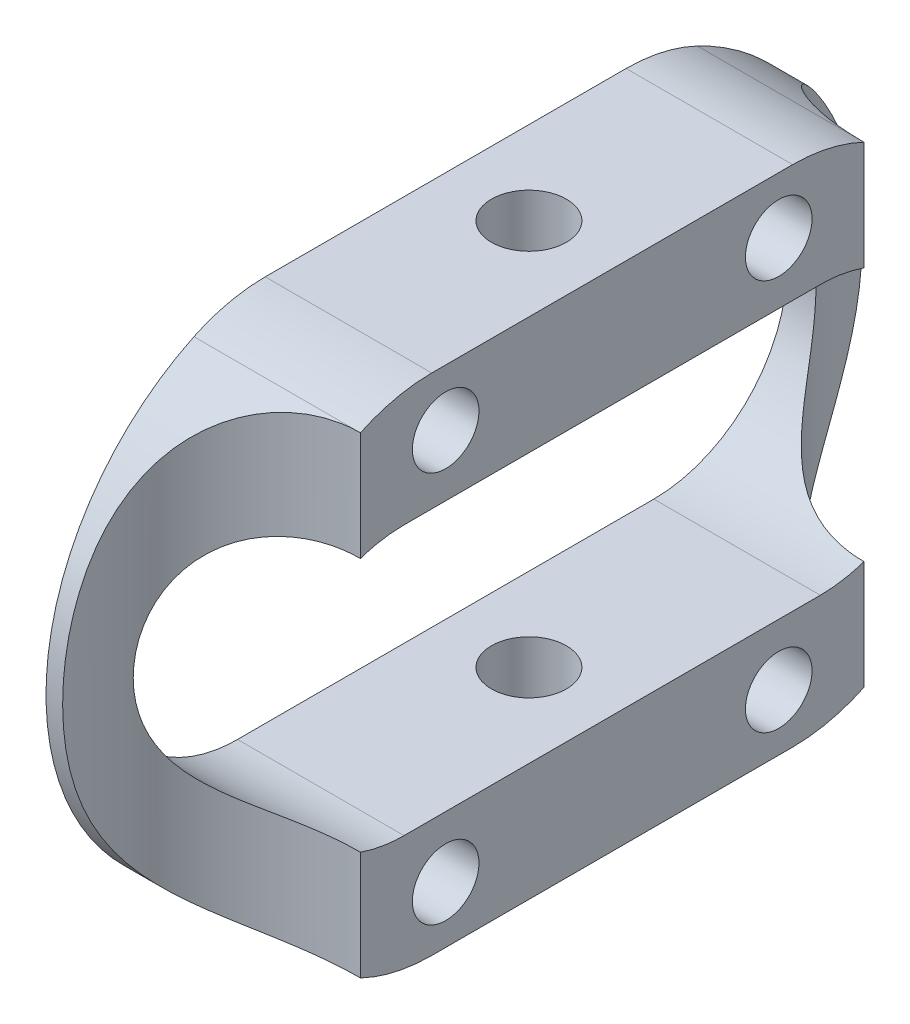
from build123d import *

# Parameters (mm, degrees)
SZKIC1_R                                         = 4
DODANIE_WYCI_GNI_CIE1_DEPTH                      = 20
WYTNIJ_WYCI_GNI_CIE4_DEPTH                       = 80.844262412
WYTNIJ_WYCI_GNI_CIE4_DEPTH_BACK                  = 80.844262412
POG_BIENIE_STO_KOWE_POD_M8_RUB_Z_BEM_D           = 9
POG_BIENIE_STO_KOWE_POD_M8_RUB_Z_BEM_CSINK_D     = 17.3
POG_BIENIE_STO_KOWE_POD_M8_RUB_Z_BEM_CSINK_ANGLE = 90


with BuildPart() as part:
    # Szkic1 → Dodanie-wyciągnięcie1 (new body)
    with BuildSketch(Plane(origin=(0, 0, 0), x_dir=(0, 0, -1), z_dir=(1, 0, 0))):
        with BuildLine():
            add(Edge.make_bspline(
                [(-21.671768561, 30.294827176), (-26.169216525, 30.294827176), (-30.233707808, 28.350561908)],
                knots=[3.141592654, 3.141592654, 3.141592654, 3.583978625, 3.583978625, 3.583978625], degree=2, weights=[1, 0.97563641, 1]))
            add(Edge.make_bspline(
                [(-30.233707808, 28.350561908), (-89.500626622, 0), (-30.233707808, -28.350561908)],
                knots=[3.583978625, 3.583978625, 3.583978625, 5.840799336, 5.840799336, 5.840799336], degree=2, weights=[1, 0.428096962, 1]))
            add(Edge.make_bspline(
                [(-30.233707808, -28.350561908), (-26.169216525, -30.294827176), (-21.671768561, -30.294827176)],
                knots=[2.699206682, 2.699206682, 2.699206682, 3.141592654, 3.141592654, 3.141592654], degree=2, weights=[1, 0.97563641, 1]))
            Line((-21.671768561, -30.294827176), (21.671768561, -30.294827176))
            add(Edge.make_bspline(
                [(21.671768561, -30.294827176), (26.169216525, -30.294827176), (30.233707808, -28.350561908)],
                knots=[0, 0, 0, 0.442385972, 0.442385972, 0.442385972], degree=2, weights=[1, 0.97563641, 1]))
            add(Edge.make_bspline(
                [(30.233707808, -28.350561908), (89.500626622, 0), (30.233707808, 28.350561908)],
                knots=[0.442385972, 0.442385972, 0.442385972, 2.699206682, 2.699206682, 2.699206682], degree=2, weights=[1, 0.428096962, 1]))
            add(Edge.make_bspline(
                [(30.233707808, 28.350561908), (26.169216525, 30.294827176), (21.671768561, 30.294827176)],
                knots=[2.699206682, 2.699206682, 2.699206682, 3.141592654, 3.141592654, 3.141592654], degree=2, weights=[1, 0.97563641, 1]))
            Line((21.671768561, 30.294827176), (-21.671768561, 30.294827176))
        make_face()
        with Locations((-20, 23.5)):
            Circle(SZKIC1_R, mode=Mode.SUBTRACT)
        with Locations((20, 23.5)):
            Circle(SZKIC1_R, mode=Mode.SUBTRACT)
        with Locations((-20, -23.5)):
            Circle(SZKIC1_R, mode=Mode.SUBTRACT)
        with Locations((20, -23.5)):
            Circle(SZKIC1_R, mode=Mode.SUBTRACT)
        with BuildLine():
            add(Edge.make_bspline(
                [(25, -16.15724116), (41, -16.15724116), (41, 0), (41, 16.15724116), (25, 16.15724116)],
                knots=[3.141592654, 3.141592654, 3.141592654, 4.71238898, 4.71238898, 6.283185307, 6.283185307, 6.283185307], degree=2, weights=[1, 0.707106781, 1, 0.707106781, 1]))
            Line((25, 16.15724116), (-25, 16.15724116))
            add(Edge.make_bspline(
                [(-25, 16.15724116), (-41, 16.15724116), (-41, 0), (-41, -16.15724116), (-25, -16.15724116)],
                knots=[0, 0, 0, 1.570796327, 1.570796327, 3.141592654, 3.141592654, 3.141592654], degree=2, weights=[1, 0.707106781, 1, 0.707106781, 1]))
            Line((-25, -16.15724116), (25, -16.15724116))
        make_face(mode=Mode.SUBTRACT)
    extrude(amount=DODANIE_WYCI_GNI_CIE1_DEPTH)

    # Szkic2 → Wytnij-wyciągnięcie4 (cut, two sides: drawn at the far end of the back side and taken through both)
    with BuildSketch(Plane.XZ.offset(30.294827176).offset(-WYTNIJ_WYCI_GNI_CIE4_DEPTH_BACK)):
        with BuildLine():
            Line((2, 48), (2, 49.871745004))
            Line((2, 49.871745004), (22.127967947, 49.871745004))
            Line((22.127967947, 49.871745004), (22.127967947, 30.233707808))
            Line((22.127967947, 30.233707808), (20, 30.233707808))
            ThreePointArc((20, 30.233707808), (7.320480411, 35.388931843), (2, 48))
        make_face()
        with BuildLine():
            Line((22.127967947, -30.233707808), (20, -30.233707808))
            ThreePointArc((20, -30.233707808), (7.320480411, -35.388931843), (2, -48))
            Line((2, -48), (2, -49.871745004))
            Line((2, -49.871745004), (22.127967947, -49.871745004))
            Line((22.127967947, -49.871745004), (22.127967947, -30.233707808))
        make_face()
    extrude(amount=WYTNIJ_WYCI_GNI_CIE4_DEPTH + WYTNIJ_WYCI_GNI_CIE4_DEPTH_BACK, mode=Mode.SUBTRACT)

    # Pogłębienie stożkowe pod M8 Śrubę z łbem soczewkowym1 (through all)
    with Locations(Plane(origin=(10, -30.294827176, 0), x_dir=(0, 0, -1), z_dir=(0, -1, 0))):
        with Locations((0, 0)):
            CounterSinkHole(POG_BIENIE_STO_KOWE_POD_M8_RUB_Z_BEM_D / 2, POG_BIENIE_STO_KOWE_POD_M8_RUB_Z_BEM_CSINK_D / 2, counter_sink_angle=POG_BIENIE_STO_KOWE_POD_M8_RUB_Z_BEM_CSINK_ANGLE)


solid = part.part
